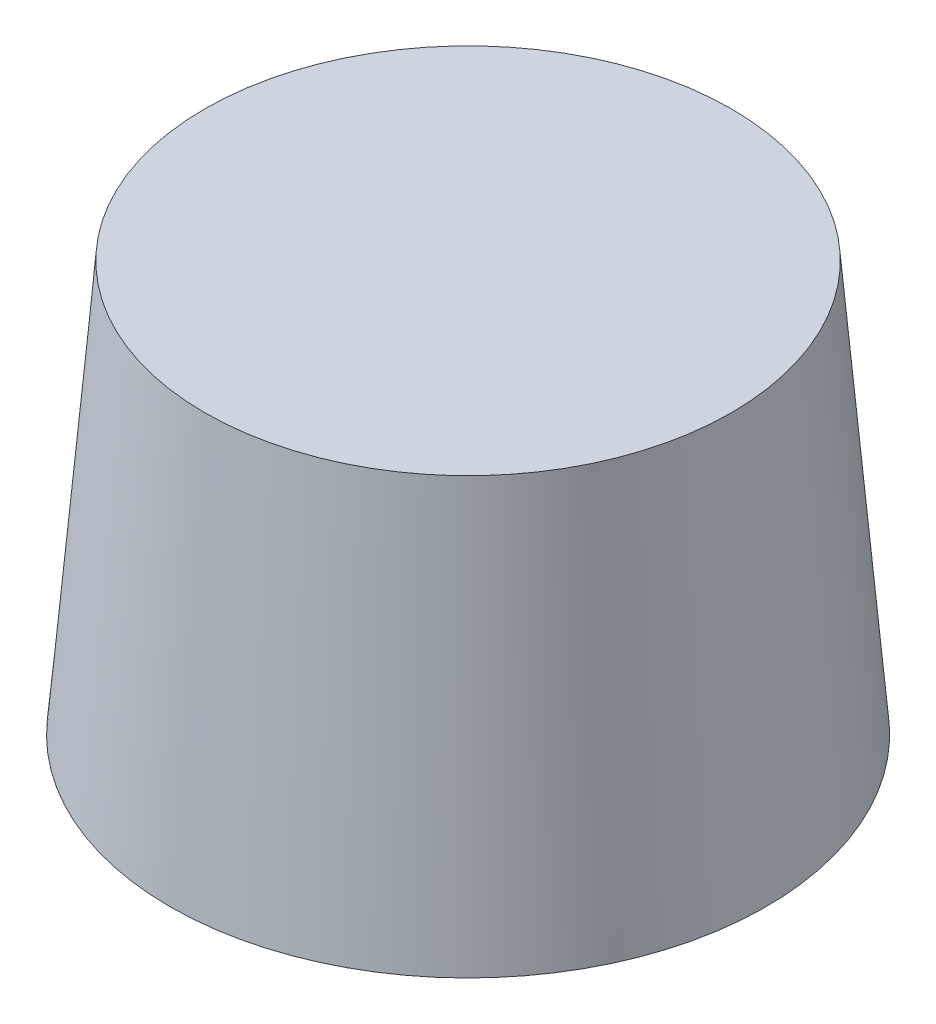
from build123d import *


with BuildPart() as part:
    # Sketch2 → Revolve1 (revolve)
    with BuildSketch(Plane.XY, mode=Mode.PRIVATE) as revolve1_sk:
        Polygon((0, 53), (34, 53), (38.5, 0), (0, 0), align=None)
    revolve(revolve1_sk.sketch.rotate(Axis((0, 37.693158885, 0), (0, -1, 0)), 90), axis=Axis((0, 37.693158885, 0), (0, -1, 0)))


solid = part.part
